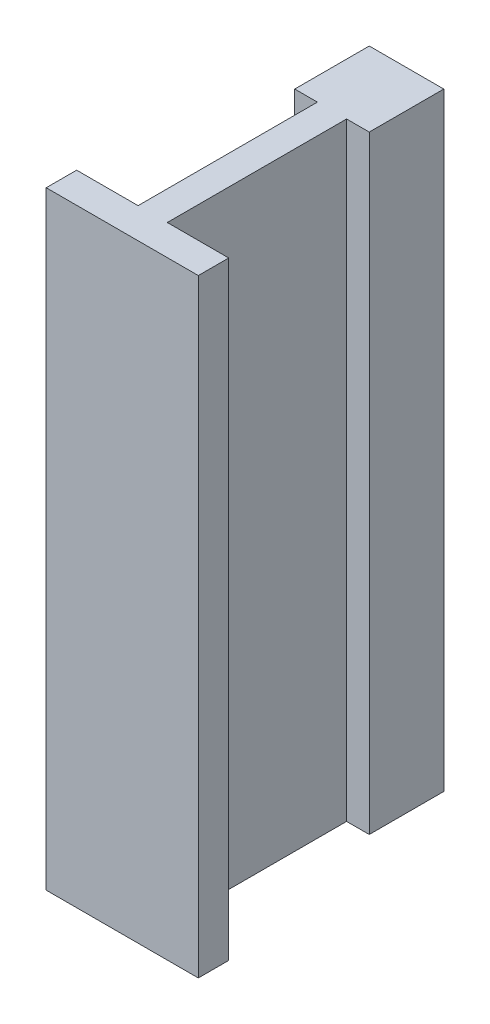
from build123d import *

# Parameters (mm, degrees)
EXTRUDE_1_DEPTH = 40
SKETCH_3_W      = 1.92
SKETCH_3_H      = 1.335454545
EXTRUDE_2_DEPTH = 40
SKETCH_4_W      = 1.92
SKETCH_4_H      = 40
EXTRUDE_3_DEPTH = 1
SKETCH_5_W      = 1.92
SKETCH_5_H      = 40
EXTRUDE_4_DEPTH = 10
SKETCH_7_W      = 10
SKETCH_7_H      = 2
EXTRUDE_5_DEPTH = 40


with BuildPart() as part:
    # 草圖2 → 填料-伸長1 (new body)
    with BuildSketch(Plane(origin=(0, 0, 0), x_dir=(1, 0, 0), z_dir=(0, 1, 0))):
        Polygon((-1.169090909, -3.013636364), (-1.169090909, -1.559090909), (-2.659090909, -1.559090909), (-2.659090909, 3.340909091), (2.240909091, 3.340909091), (2.240909091, -1.559090909), (0.750909091, -1.559090909), (0.750909091, -3.013636364), align=None)
    extrude(amount=EXTRUDE_1_DEPTH)

    # 草圖3 → 填料-伸長2 (add)
    with BuildSketch(Plane(origin=(0, 40, 0), x_dir=(1, 0, 0), z_dir=(0, 1, 0))):
        with Locations((-0.209090909, -3.681363637)):
            Rectangle(SKETCH_3_W, SKETCH_3_H)
    extrude(amount=-EXTRUDE_2_DEPTH)

    # 草圖4 → 填料-伸長3 (add)
    with BuildSketch(Plane.XY.offset(4.349090909)):
        with Locations((-0.209090909, 20)):
            Rectangle(SKETCH_4_W, SKETCH_4_H)
    extrude(amount=EXTRUDE_3_DEPTH)

    # 草圖5 → 填料-伸長4 (add)
    with BuildSketch(Plane.XY.offset(5.349090909)):
        with Locations((-0.209090909, 20)):
            Rectangle(SKETCH_5_W, SKETCH_5_H)
    extrude(amount=EXTRUDE_4_DEPTH)

    # 草圖7 → 填料-伸長5 (add)
    with BuildSketch(Plane(origin=(0, 40, 0), x_dir=(1, 0, 0), z_dir=(0, 1, 0))):
        with Locations((-0.209090909, -14.349090909)):
            Rectangle(SKETCH_7_W, SKETCH_7_H)
    extrude(amount=-EXTRUDE_5_DEPTH)


solid = part.part
